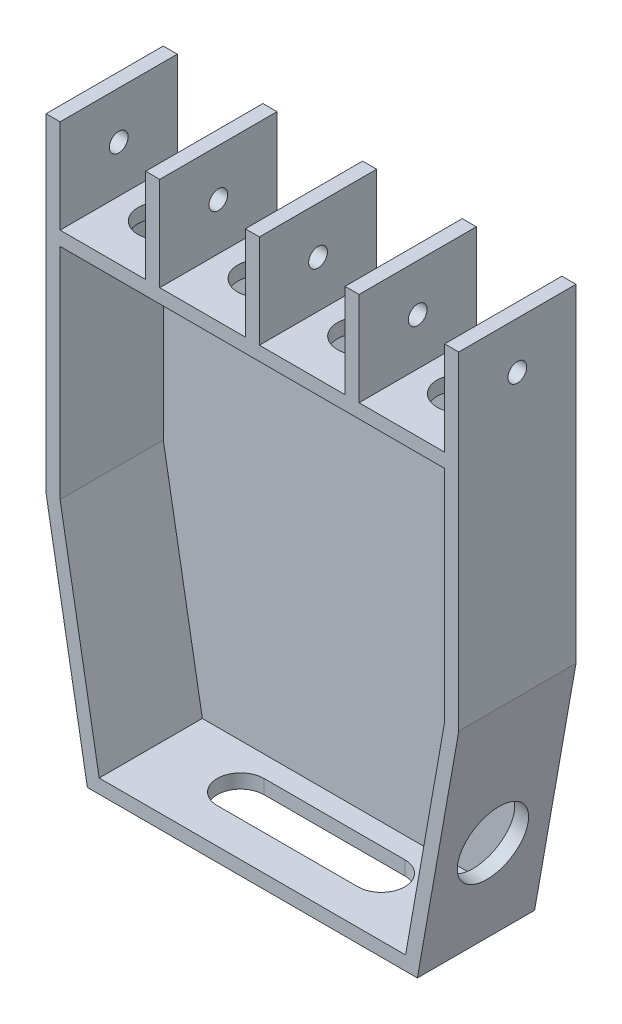
from build123d import *

# Parameters (mm, degrees)
BOSS_EXTRUDE2_DEPTH = 3
BOSS_EXTRUDE3_DEPTH = 25
SKETCH3_W           = 3
SKETCH3_H           = 20
BOSS_EXTRUDE4_DEPTH = 25
SKETCH4_R           = 7.5
CUT_EXTRUDE1_DEPTH  = 6
CUT_EXTRUDE2_DEPTH  = 6
SKETCH6_R           = 5
CUT_EXTRUDE3_DEPTH  = 6
SKETCH7_R           = 2
CUT_EXTRUDE4_DEPTH  = 153


with BuildPart() as part:
    # Sketch2 → Boss-Extrude2 (new body)
    # profile 1 of 2: a face of its own
    with BuildSketch(Plane.XY):
        Polygon((-11.333647929, 47), (-11.333647929, 97), (76.666352071, 97), (76.666352071, 47), (67.850003036, -3), (-2.517298894, -3), align=None)
        Polygon((0, 0), (-8.333647929, 47.262465991), (-8.333647929, 94), (73.666352071, 94), (73.666352071, 47.262465991), (65.332704142, 0), align=None, mode=Mode.SUBTRACT)
    # profile 2 of 2: a face of its own
    with BuildSketch(Plane.XY):
        Polygon((-8.333647929, 47.262465991), (-8.333647929, 94), (73.666352071, 94), (73.666352071, 47.262465991), (65.332704142, 0), (0, 0), align=None)
    extrude(amount=BOSS_EXTRUDE2_DEPTH)

    # Sketch2<4> → Boss-Extrude3 (add)
    with BuildSketch(Plane.XY):
        Polygon((-11.333647929, 97), (76.666352071, 97), (76.666352071, 47), (67.850003036, -3), (-2.517298894, -3), (-11.333647929, 47), align=None)
        Polygon((-8.333647929, 94), (73.666352071, 94), (73.666352071, 47.262465991), (65.332704142, 0), (0, 0), (-8.333647929, 47.262465991), align=None, mode=Mode.SUBTRACT)
    extrude(amount=BOSS_EXTRUDE3_DEPTH)

    # Sketch3 → Boss-Extrude4 (add)
    with BuildSketch(Plane(origin=(0, 0, 0), x_dir=(-1, 0, 0), z_dir=(0, 0, -1))):
        with Locations((9.833647929, 107)):
            Rectangle(SKETCH3_W, SKETCH3_H)
        with Locations((-11.416352071, 107)):
            Rectangle(SKETCH3_W, SKETCH3_H)
        with Locations((-32.666352071, 107)):
            Rectangle(SKETCH3_W, SKETCH3_H)
        with Locations((-53.916352071, 107)):
            Rectangle(SKETCH3_W, SKETCH3_H)
        with Locations((-75.166352071, 107)):
            Rectangle(SKETCH3_W, SKETCH3_H)
    extrude(amount=-BOSS_EXTRUDE4_DEPTH)

    # Sketch4 → Cut-Extrude1 (cut)
    with BuildSketch(Plane(origin=(66.317105319, -11.69349495, 0), x_dir=(0, 0, -1), z_dir=(0.9848077530122088, -0.17364817766692645, 0))):
        with Locations(Location((-12.5, 29.630807288, 0), (0, 0, 90))):
            Circle(SKETCH4_R)
    extrude(amount=-CUT_EXTRUDE1_DEPTH, mode=Mode.SUBTRACT)

    # Sketch5 → Cut-Extrude2 (cut)
    with BuildSketch(Plane.XZ.offset(3)):
        with BuildLine():
            Line((47.666352071, 7.5), (17.666352071, 7.5))
            ThreePointArc((17.666352071, 7.5), (12.666352071, 12.5), (17.666352071, 17.5))
            Line((17.666352071, 17.5), (47.666352071, 17.5))
            ThreePointArc((47.666352071, 17.5), (52.666352071, 12.5), (47.666352071, 7.5))
        make_face()
    extrude(amount=-CUT_EXTRUDE2_DEPTH, mode=Mode.SUBTRACT)

    # Sketch6 → Cut-Extrude3 (cut)
    with BuildSketch(Plane(origin=(0, 97, 0), x_dir=(1, 0, 0), z_dir=(0, 1, 0))):
        with Locations(Location((0.791352071, -12.5, 0), (0, 0, 270))):
            Circle(SKETCH6_R)
        with Locations(Location((22.041352071, -12.5, 0), (0, 0, 270))):
            Circle(SKETCH6_R)
        with Locations(Location((43.291352071, -12.5, 0), (0, 0, 270))):
            Circle(SKETCH6_R)
        with Locations(Location((64.541352071, -12.5, 0), (0, 0, 270))):
            Circle(SKETCH6_R)
    extrude(amount=-CUT_EXTRUDE3_DEPTH, mode=Mode.SUBTRACT)

    # Sketch7 → Cut-Extrude4 (cut)
    with BuildSketch(Plane.ZY.offset(11.333647929)):
        with Locations((12.5, 107)):
            Circle(SKETCH7_R)
    extrude(amount=-CUT_EXTRUDE4_DEPTH, mode=Mode.SUBTRACT)


solid = part.part
